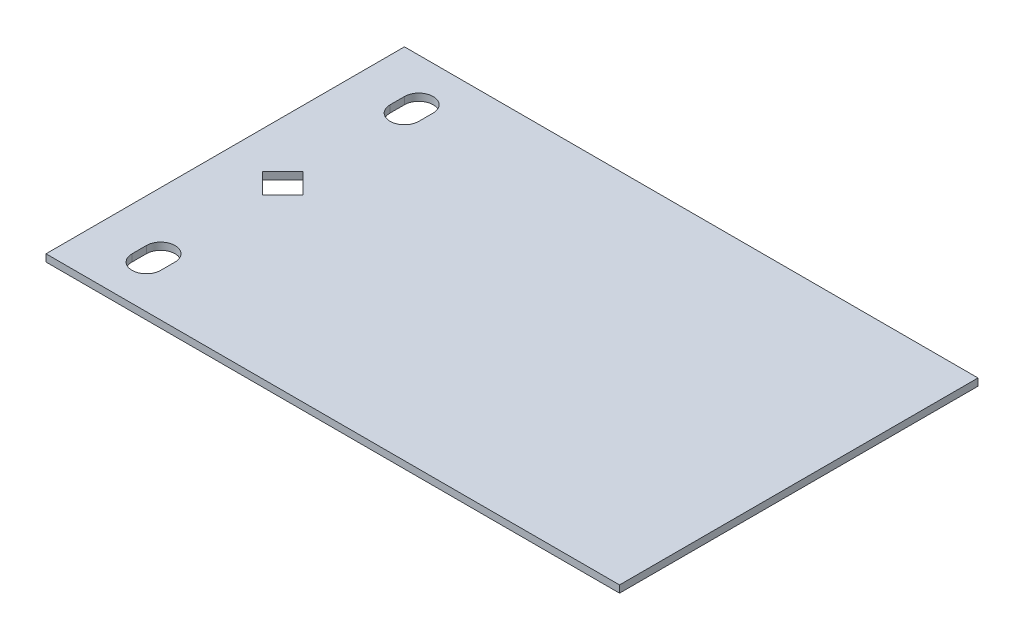
from build123d import *

# Parameters (mm, degrees)
SKETCH_1_W      = 80
SKETCH_1_H      = 50
EXTRUDE_2_DEPTH = 1


with BuildPart() as part:
    # Эскиз1 → Бобышка-Вытянуть2 (new body)
    with BuildSketch(Plane(origin=(0, 0, 0), x_dir=(1, 0, 0), z_dir=(0, 1, 0))):
        Rectangle(SKETCH_1_W, SKETCH_1_H)
        Polygon((-34.828427125, 0), (-32, -2.828427125), (-29.171572875, 0), (-32, 2.828427125), align=None, mode=Mode.SUBTRACT)
        with BuildLine():
            Line((-30, -19), (-30, -17))
            ThreePointArc((-30, -17), (-32, -15), (-34, -17))
            Line((-34, -17), (-34, -19))
            ThreePointArc((-34, -19), (-32, -21), (-30, -19))
        make_face(mode=Mode.SUBTRACT)
        with BuildLine():
            Line((-34, 19), (-34, 17))
            ThreePointArc((-34, 17), (-32, 15), (-30, 17))
            Line((-30, 17), (-30, 19))
            ThreePointArc((-30, 19), (-32, 21), (-34, 19))
        make_face(mode=Mode.SUBTRACT)
    extrude(amount=EXTRUDE_2_DEPTH)


solid = part.part
